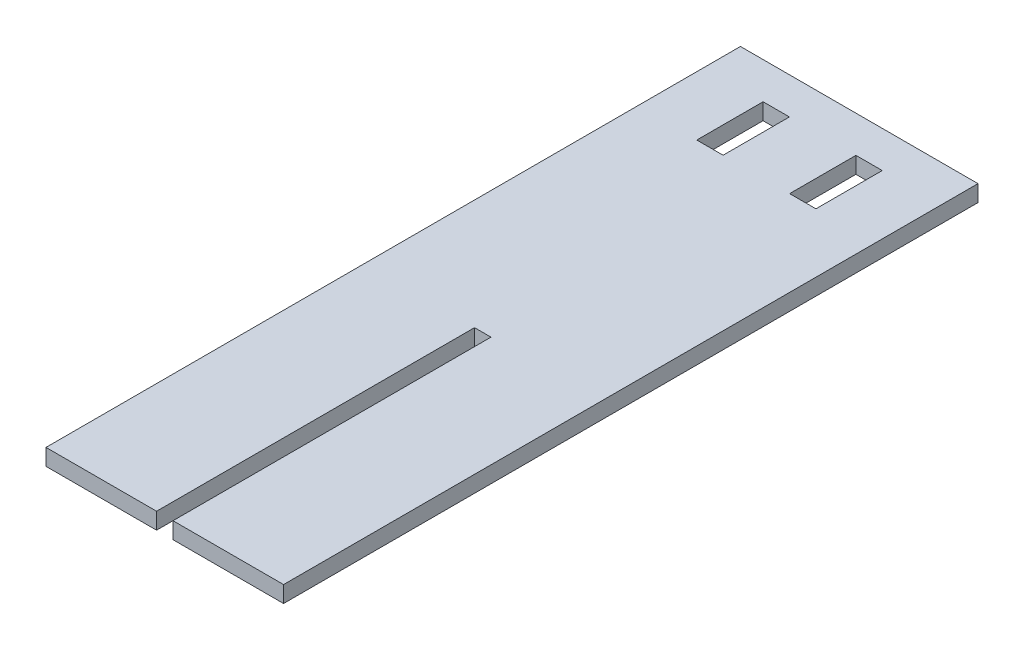
from build123d import *

# Parameters (mm, degrees)
SKETCH1_W           = 9.144
SKETCH1_H           = 23.0378
BOSS_EXTRUDE1_DEPTH = 5.715


with BuildPart() as part:
    # Sketch1 → Boss-Extrude1 (new body)
    # profile 1 of 2: a face of its own
    with BuildSketch(Plane(origin=(0, 0, 0), x_dir=(1, 0, 0), z_dir=(0, 1, 0))):
        Polygon((38.4175, 110.49), (41.275, 110.49), (44.1325, 110.49), (44.1325, 0), (82.55, 0), (82.55, 241.3), (0, 241.3), (0, 0), (38.4175, 0), align=None)
        with Locations((25.146, 217.0811)):
            Rectangle(SKETCH1_W, SKETCH1_H, mode=Mode.SUBTRACT)
        with Locations((57.404, 217.0811)):
            Rectangle(SKETCH1_W, SKETCH1_H, mode=Mode.SUBTRACT)
    # profile 2 of 2: a face of its own
    with BuildSketch(Plane(origin=(0, 0, 0), x_dir=(1, 0, 0), z_dir=(0, 1, 0))):
        Polygon((38.4175, 110.49), (41.275, 110.49), (44.1325, 110.49), (44.1325, 0), (82.55, 0), (82.55, 241.3), (0, 241.3), (0, 0), (38.4175, 0), align=None)
        with Locations((25.146, 217.0811)):
            Rectangle(SKETCH1_W, SKETCH1_H, mode=Mode.SUBTRACT)
        with Locations((57.404, 217.0811)):
            Rectangle(SKETCH1_W, SKETCH1_H, mode=Mode.SUBTRACT)
    extrude(amount=BOSS_EXTRUDE1_DEPTH)


solid = part.part
